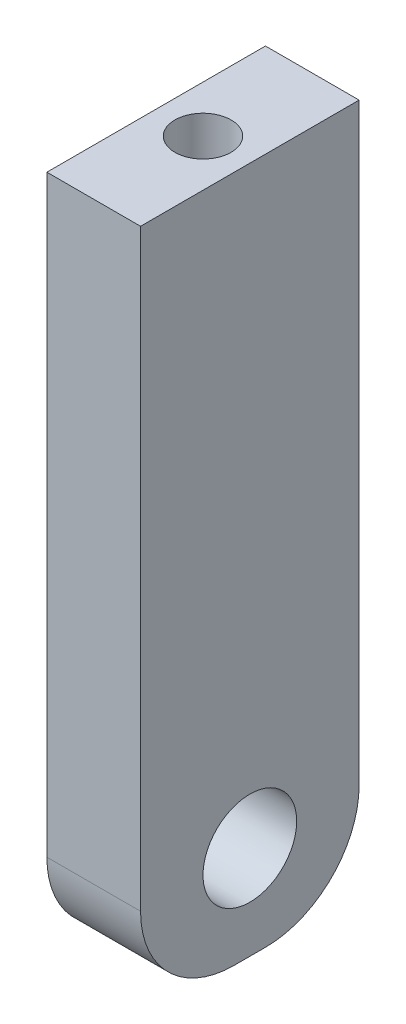
from build123d import *

# Parameters (mm, degrees)
SKETCH_1_W          = 3
SKETCH_1_H          = 22
EXTRUDE_1_DEPTH     = 7
SKETCH_4_R          = 1.5
CUT_EXTRUDE_2_DEPTH = 23.765394656
FILLET_1_R          = 3
SKETCH_3_R          = 0.9
CUT_EXTRUDE_4_DEPTH = 7


with BuildPart() as part:
    # 草图1 → 凸台-拉伸1 (new body)
    with BuildSketch(Plane.XY):
        with Locations((1.5, -10.453745451)):
            Rectangle(SKETCH_1_W, SKETCH_1_H)
    extrude(amount=EXTRUDE_1_DEPTH)

    # 草图4 → 切除-拉伸2 (cut, through all)
    with BuildSketch(Plane(origin=(3, 0, 0), x_dir=(0, 0, -1), z_dir=(1, 0, 0))):
        with Locations((-3.5, -18.453745451)):
            Circle(SKETCH_4_R)
    extrude(amount=-CUT_EXTRUDE_2_DEPTH, mode=Mode.SUBTRACT)

    # 圆角1
    fillet_1_edges = [part.edges().sort_by_distance(p)[0] for p in [
        (1.5, -21.453745451, 7),
        (1.5, -21.453745451, 0),
    ]]
    fillet(fillet_1_edges, radius=FILLET_1_R)

    # 草图3 → 切除-拉伸4 (cut)
    with BuildSketch(Plane(origin=(0, 0.546254549, 0), x_dir=(1, 0, 0), z_dir=(0, 1, 0))):
        with Locations(Location((1.5, -3.5, 0), (0, 0, 180))):
            Circle(SKETCH_3_R)
    extrude(amount=-CUT_EXTRUDE_4_DEPTH, mode=Mode.SUBTRACT)


solid = part.part
